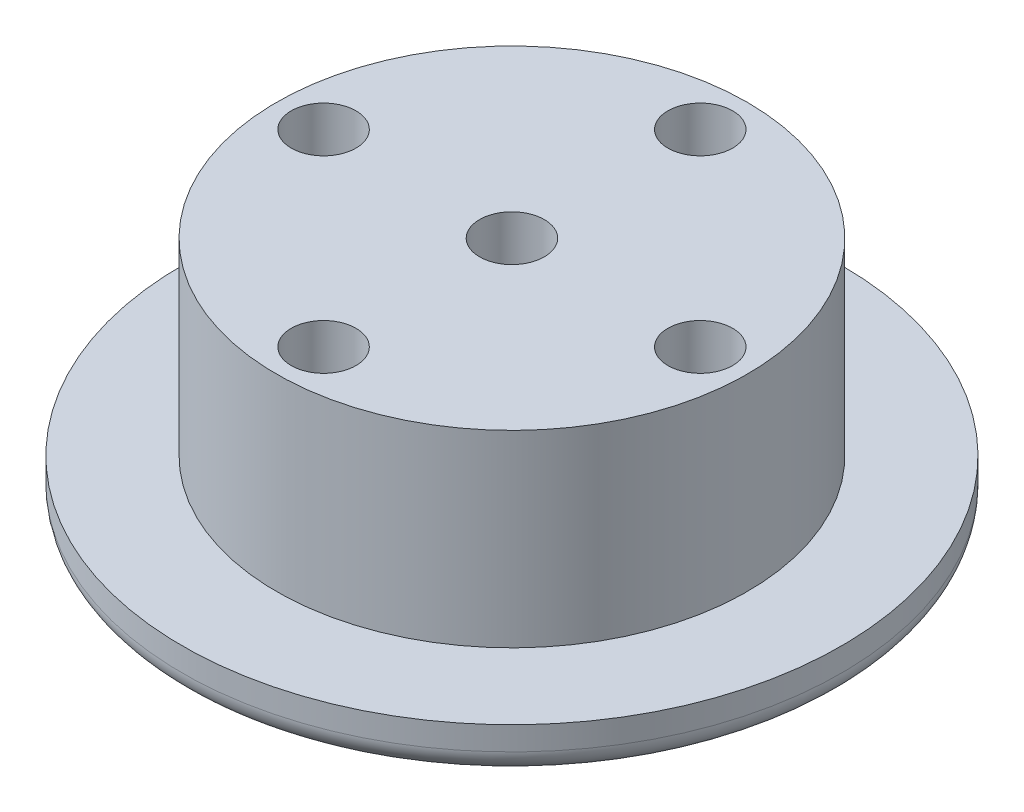
from build123d import *

# Parameters (mm, degrees)
CUT_EXTRUDE1_DEPTH      = 36.212453408
CUT_EXTRUDE1_DEPTH_BACK = 36.212453408
SKETCH3_R               = 2.1828125


with BuildPart() as part:
    # Sketch1 → Revolve2 (revolve)
    with BuildSketch(Plane.XY, mode=Mode.PRIVATE) as revolve2_sk:
        with BuildLine():
            Line((0, 0), (0, 15.875))
            Line((0, 15.875), (15.875, 15.875))
            Line((15.875, 15.875), (15.875, 3.175))
            Line((15.875, 3.175), (22.225, 3.175))
            Line((22.225, 3.175), (22.225, 1.5875))
            ThreePointArc((22.225, 1.5875), (21.760032015, 0.464967985), (20.6375, 0))
            Line((20.6375, 0), (0, 0))
        make_face()
    revolve(revolve2_sk.sketch.rotate(Axis((0, 0, 0), (0, 1, 0)), 90), axis=Axis((0, 0, 0), (0, 1, 0)))

    # Sketch3 → Cut-Extrude1 (cut, two sides: drawn at the far end of the back side and taken through both)
    with BuildSketch(Plane(origin=(0, 15.875, 0), x_dir=(1, 0, 0), z_dir=(0, 1, 0)).offset(-CUT_EXTRUDE1_DEPTH_BACK)):
        with Locations(Location((0, 0, 0), (0, 0, 270))):
            Circle(SKETCH3_R)
        with Locations(Location((12.7, 0, 0), (0, 0, 270))):
            Circle(SKETCH3_R)
        with Locations(Location((-12.7, 0, 0), (0, 0, 270))):
            Circle(SKETCH3_R)
        with Locations(Location((0, -12.7, 0), (0, 0, 270))):
            Circle(SKETCH3_R)
        with Locations(Location((0, 12.7, 0), (0, 0, 270))):
            Circle(SKETCH3_R)
    extrude(amount=CUT_EXTRUDE1_DEPTH + CUT_EXTRUDE1_DEPTH_BACK, mode=Mode.SUBTRACT)


solid = part.part
